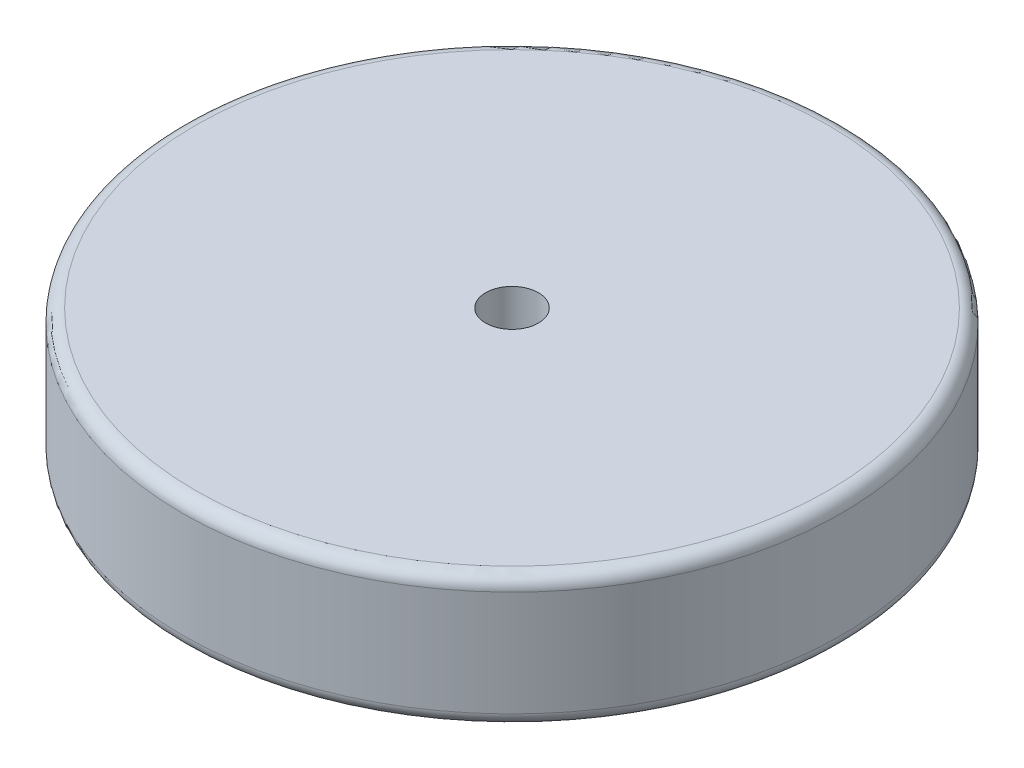
from build123d import *

# Parameters (mm, degrees)
SKETCH1_R           = 25
SKETCH1_R_2         = 2
BOSS_EXTRUDE1_DEPTH = 10
FILLET1_R           = 1


with BuildPart() as part:
    # Sketch1 → Boss-Extrude1 (new body)
    with BuildSketch(Plane(origin=(0, 0, 0), x_dir=(1, 0, 0), z_dir=(0, 1, 0))):
        with Locations(Location((0, 0, 0), (0, 0, 270))):
            Circle(SKETCH1_R)
        with Locations(Location((0, 0, 0), (0, 0, 270))):
            Circle(SKETCH1_R_2, mode=Mode.SUBTRACT)
    extrude(amount=BOSS_EXTRUDE1_DEPTH)

    # Fillet1
    fillet1_edges = [part.edges().sort_by_distance(p)[0] for p in [
        (0, 0, -25),
        (0, 10, -25),
    ]]
    fillet(fillet1_edges, radius=FILLET1_R)


solid = part.part
